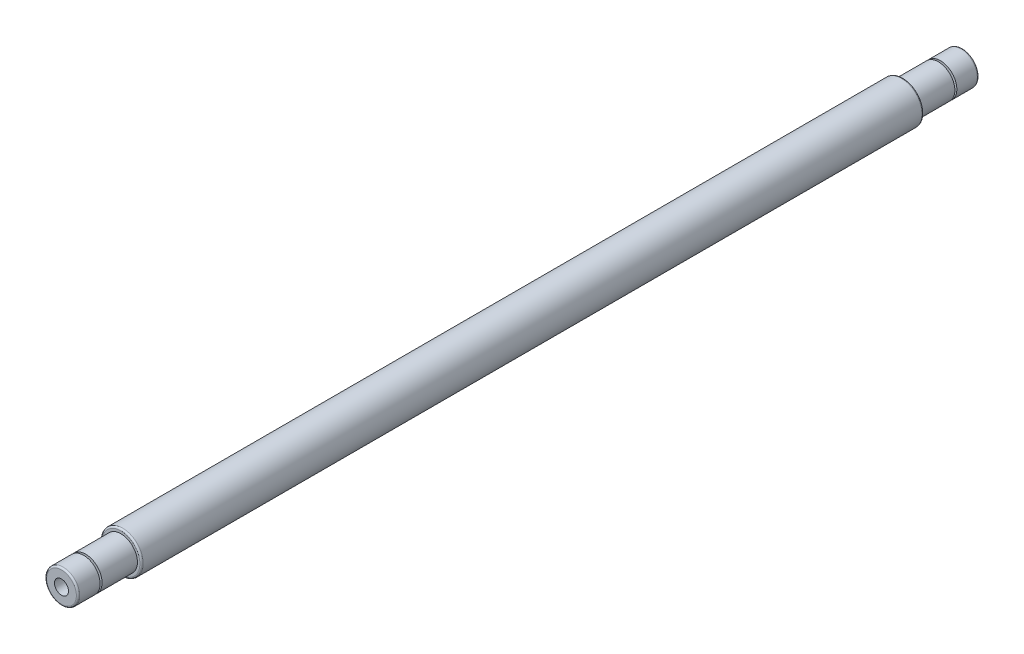
from build123d import *

# Parameters (mm, degrees)
IZIM1_R                     = 12.5
Y_KSEKLIK_EKSTR_ZYON1_DEPTH = 546
IZIM2_R                     = 4.25
KES_EKSTR_ZYON1_DEPTH       = 20
KES_EKSTR_ZYON2_START       = -20
IZIM3_R                     = 4.25
KES_EKSTR_ZYON2_DEPTH       = 20
KES_EKSTR_ZYON3_START       = -36
IZIM4_R                     = 12.5
IZIM4_R_2                   = 10
KES_EKSTR_ZYON3_DEPTH       = 36
IZIM5_R                     = 12.5
IZIM5_R_2                   = 10
KES_EKSTR_ZYON4_DEPTH       = 36
IZIM8_W                     = 3.7
IZIM8_H                     = 1.2
RADYUS1_R                   = 1


with BuildPart() as part:
    # Çizim1 → Yükseklik-Ekstrüzyon1 (new body)
    with BuildSketch(Plane.XY):
        Circle(IZIM1_R)
    extrude(amount=Y_KSEKLIK_EKSTR_ZYON1_DEPTH)

    # Çizim2 → Kes-Ekstrüzyon1 (cut)
    with BuildSketch(Plane.XY.offset(546)):
        Circle(IZIM2_R)
    extrude(amount=-KES_EKSTR_ZYON1_DEPTH, mode=Mode.SUBTRACT)

    # Çizim3 → Kes-Ekstrüzyon2 (cut)
    with BuildSketch(Plane(origin=(0, 0, 0), x_dir=(-1, 0, 0), z_dir=(0, 0, -1)).offset(KES_EKSTR_ZYON2_START)):
        with Locations(Location((0, 0, 0), (0, 0, 180))):
            Circle(IZIM3_R)
    extrude(amount=KES_EKSTR_ZYON2_DEPTH, mode=Mode.SUBTRACT)

    # Çizim4 → Kes-Ekstrüzyon3 (cut)
    with BuildSketch(Plane.XY.offset(546).offset(KES_EKSTR_ZYON3_START)):
        Circle(IZIM4_R)
        Circle(IZIM4_R_2, mode=Mode.SUBTRACT)
    extrude(amount=KES_EKSTR_ZYON3_DEPTH, mode=Mode.SUBTRACT)

    # Çizim5 → Kes-Ekstrüzyon4 (cut)
    with BuildSketch(Plane(origin=(0, 0, 0), x_dir=(-1, 0, 0), z_dir=(0, 0, -1))):
        Circle(IZIM5_R)
        with Locations(Location((0, 0, 0), (0, 0, 180))):
            Circle(IZIM5_R_2, mode=Mode.SUBTRACT)
    extrude(amount=-KES_EKSTR_ZYON4_DEPTH, mode=Mode.SUBTRACT)

    # Çizim8 → Kes-Döndür1 (revolve, cut)
    with BuildSketch(Plane(origin=(0, 0, 0), x_dir=(1, 0, 0), z_dir=(0, 1, 0))):
        with Locations((-10, -14)):
            Rectangle(IZIM8_W, IZIM8_H)
        with Locations((-10, -532)):
            Rectangle(IZIM8_W, IZIM8_H)
    revolve(axis=Axis((0, 0, 0), (0, 0, 1)), mode=Mode.SUBTRACT)

    # Radyus1
    radyus1_edges = [part.edges().sort_by_distance(p)[0] for p in [
        (-12.5, 0, 510),
        (-10, 0, 546),
        (-12.5, 0, 36),
        (-10, 0, 0),
    ]]
    fillet(radyus1_edges, radius=RADYUS1_R)


solid = part.part
